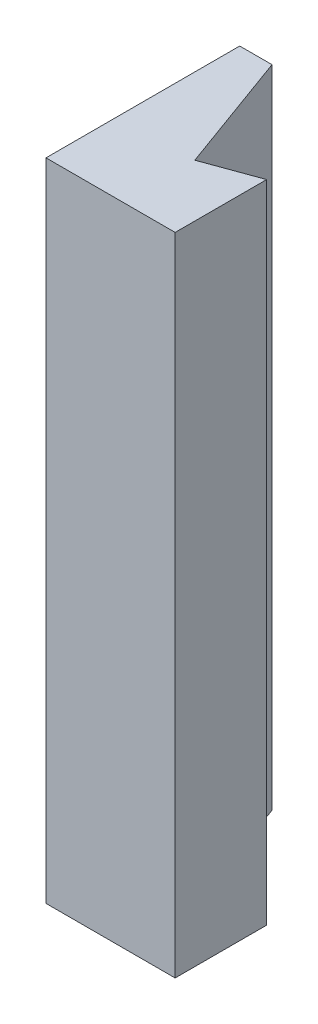
from build123d import *

# Parameters (mm, degrees)
BOSS_EXTRUDE2_DEPTH = 127


with BuildPart() as part:
    # Sketch1 → Boss-Extrude2 (new body)
    with BuildSketch(Plane(origin=(0, 0, 0), x_dir=(1, 0, 0), z_dir=(0, 1, 0))):
        Polygon((-6.35, 19.05), (2.33731164, -4.818192568), (12.7, -1.046482458), (12.7, -19.05), (-12.7, -19.05), (-12.7, 19.05), align=None)
    extrude(amount=BOSS_EXTRUDE2_DEPTH)


solid = part.part
